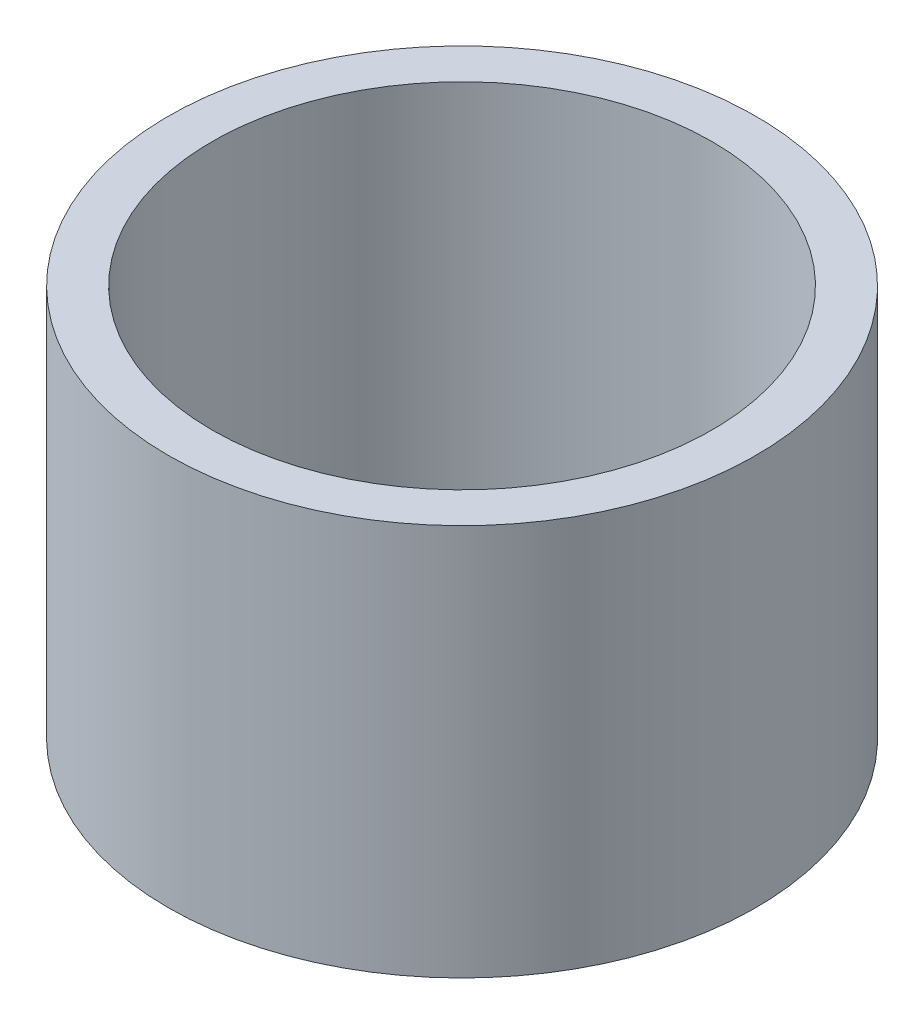
from build123d import *

# Parameters (mm, degrees)
SKETCH1_R           = 4.7625
SKETCH1_R_2         = 4.0513
BOSS_EXTRUDE1_DEPTH = 6.35


with BuildPart() as part:
    # Sketch1 → Boss-Extrude1 (new body)
    with BuildSketch(Plane(origin=(0, 0, 0), x_dir=(1, 0, 0), z_dir=(0, 1, 0))):
        with Locations(Location((0, 0, 0), (0, 0, 270))):
            Circle(SKETCH1_R)
        with Locations(Location((0, 0, 0), (0, 0, 270))):
            Circle(SKETCH1_R_2, mode=Mode.SUBTRACT)
    extrude(amount=BOSS_EXTRUDE1_DEPTH)


solid = part.part
